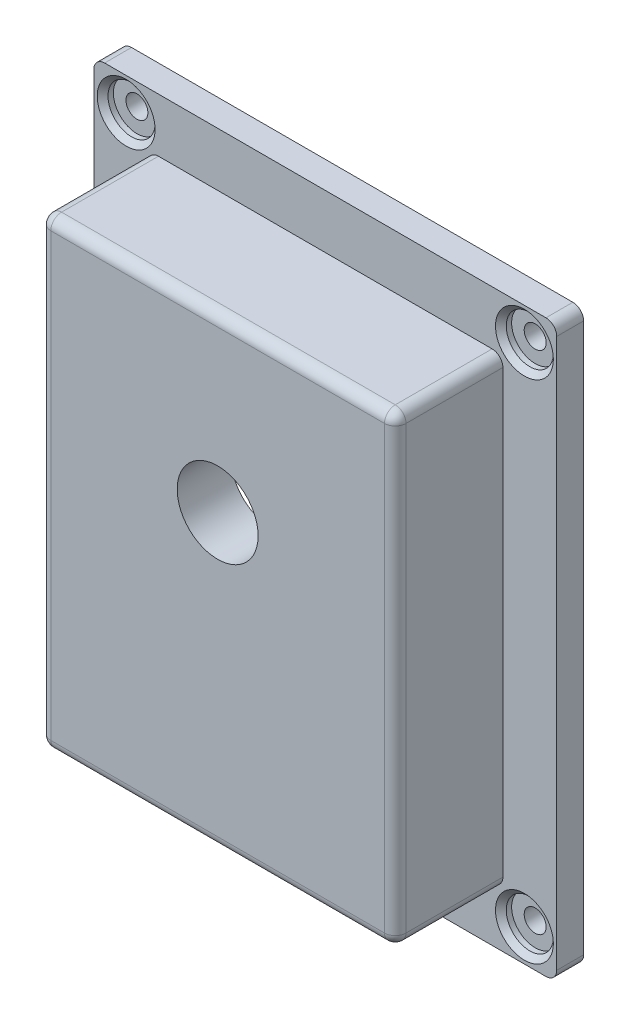
from build123d import *

# Parameters (mm, degrees)
SKETCH2_W                                   = 54.61
SKETCH2_H                                   = 41.91
SKETCH2_W_2                                 = 41.91
SKETCH2_H_2                                 = 29.21
BOSS_EXTRUDE1_DEPTH                         = 9.525
SKETCH4_W                                   = 41.91
SKETCH4_H                                   = 54.61
BOSS_EXTRUDE2_DEPTH                         = 6.35
SKETCH6_R                                   = 4.7752
CUT_EXTRUDE1_DEPTH                          = 63.012553769
SKETCH7_W                                   = 67.31
SKETCH7_H                                   = 54.61
SKETCH7_W_2                                 = 54.61
SKETCH7_H_2                                 = 41.91
BOSS_EXTRUDE3_DEPTH                         = 3.175
CBORE_FOR_2_BINDING_HEAD_MACHINE_SC_2_COUNT = 2
CBORE_FOR_2_BINDING_HEAD_MACHINE_SC_2_PITCH = 46.99
CBORE_FOR_2_BINDING_HEAD_MACHINE_SC_3_COUNT = 2
CBORE_FOR_2_BINDING_HEAD_MACHINE_SC_3_PITCH = 75.966809858
CBORE_FOR_2_BINDING_HEAD_MACHINE_SC_4_COUNT = 2
CBORE_FOR_2_BINDING_HEAD_MACHINE_SC_4_PITCH = 59.69
FILLET1_R                                   = 1.27


with BuildPart() as part:
    # Sketch2 → Boss-Extrude1 (new body)
    with BuildSketch(Plane(origin=(0, 0, 0), x_dir=(0, 1, 0), z_dir=(0, 0, 1))):
        with Locations((20.955, 14.605)):
            Rectangle(SKETCH2_W, SKETCH2_H)
        with Locations((20.955, 14.605)):
            Rectangle(SKETCH2_W_2, SKETCH2_H_2, mode=Mode.SUBTRACT)
    extrude(amount=BOSS_EXTRUDE1_DEPTH)

    # Sketch4 → Boss-Extrude2 (add)
    with BuildSketch(Plane.XY.offset(9.525)):
        with Locations((-14.605, 20.955)):
            Rectangle(SKETCH4_W, SKETCH4_H)
    extrude(amount=BOSS_EXTRUDE2_DEPTH)

    # Sketch6 → Cut-Extrude1 (cut, through all)
    with BuildSketch(Plane.XY.offset(15.875)):
        with Locations((-14.605, 28.0416)):
            Circle(SKETCH6_R)
    extrude(amount=-CUT_EXTRUDE1_DEPTH, mode=Mode.SUBTRACT)

    # Sketch7 → Boss-Extrude3 (add)
    with BuildSketch(Plane(origin=(0, 0, 0), x_dir=(0, 1, 0), z_dir=(0, 0, 1))):
        with Locations((20.955, 14.605)):
            Rectangle(SKETCH7_W, SKETCH7_H)
        with Locations((20.955, 14.605)):
            Rectangle(SKETCH7_W_2, SKETCH7_H_2, mode=Mode.SUBTRACT)
    extrude(amount=BOSS_EXTRUDE3_DEPTH)

    # Sketch9 → CBORE for #2 Binding Head Machine Screw1 (revolve, cut)
    with BuildSketch(Plane(origin=(-38.1, 50.8, 3.175), x_dir=(0, -1, 0), z_dir=(1, 0, 0))):
        Polygon((0, 0), (0, 3.175), (1.2954, 3.175), (1.2954, 1.27), (2.77876, 1.27), (2.77876, 0.635), (3.41376, 0), align=None)
    cbore_for_2_binding_head_machine_screw1 = revolve(axis=Axis((-38.1, 50.8, 9.525), (0, 0, -1)), mode=Mode.SUBTRACT)

    # CBORE for _2 Binding Head Machine Sc 2: CBORE for #2 Binding Head Machine Screw1 ×2
    with Locations(*[(i * CBORE_FOR_2_BINDING_HEAD_MACHINE_SC_2_PITCH, 0, 0) for i in range(1, CBORE_FOR_2_BINDING_HEAD_MACHINE_SC_2_COUNT)]):
        add(cbore_for_2_binding_head_machine_screw1, mode=Mode.SUBTRACT)

    # CBORE for _2 Binding Head Machine Sc 3: CBORE for #2 Binding Head Machine Screw1 ×2
    with Locations(*[Vector(0.6185596063312605, -0.7857378783126826, 0) * (i * CBORE_FOR_2_BINDING_HEAD_MACHINE_SC_3_PITCH) for i in range(1, CBORE_FOR_2_BINDING_HEAD_MACHINE_SC_3_COUNT)]):
        add(cbore_for_2_binding_head_machine_screw1, mode=Mode.SUBTRACT)

    # CBORE for _2 Binding Head Machine Sc 4: CBORE for #2 Binding Head Machine Screw1 ×2
    with Locations(*[(0, -i * CBORE_FOR_2_BINDING_HEAD_MACHINE_SC_4_PITCH, 0) for i in range(1, CBORE_FOR_2_BINDING_HEAD_MACHINE_SC_4_COUNT)]):
        add(cbore_for_2_binding_head_machine_screw1, mode=Mode.SUBTRACT)

    # Fillet1
    fillet1_edges = [part.edges().sort_by_distance(p)[0] for p in [
        (-35.56, 20.955, 15.875),
        (-14.605, -6.35, 15.875),
        (6.35, 20.955, 15.875),
        (-14.605, 48.26, 15.875),
        (-41.91, -12.7, 1.5875),
        (12.7, -12.7, 1.5875),
        (12.7, 54.61, 1.5875),
        (-41.91, 54.61, 1.5875),
        (-35.56, -6.35, 9.525),
        (-35.56, 48.26, 9.525),
        (6.35, 48.26, 9.525),
        (6.35, -6.35, 9.525),
    ]]
    fillet(fillet1_edges, radius=FILLET1_R)


solid = part.part
